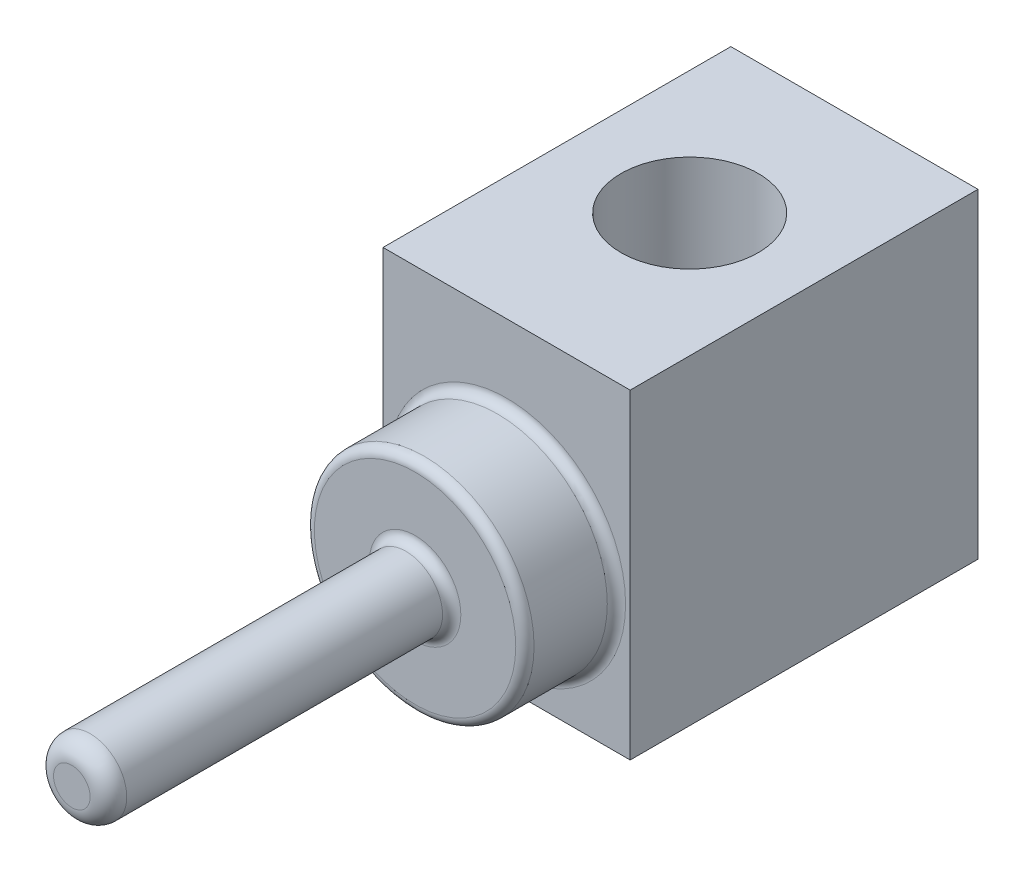
from build123d import *

# Parameters (mm, degrees)
SKETCH_1_W           = 2.7
SKETCH_1_H           = 3.5
EXTRUDE_1_DEPTH      = 3.8
SKETCH_2_OUTSIDE_W   = 5.866
SKETCH_2_OUTSIDE_H   = 6.666
SKETCH_2_OUTSIDE_W_2 = 2.7
SKETCH_2_OUTSIDE_H_2 = 3.5
SKETCH_2_OUTSIDE_R   = 1
CUT_EXTRUDE_1_DEPTH  = 5.396020928
SKETCH_4_OUTSIDE_W   = 5.866
SKETCH_4_OUTSIDE_H   = 6.966
SKETCH_4_OUTSIDE_W_2 = 2.7
SKETCH_4_OUTSIDE_H_2 = 3.8
SKETCH_4_OUTSIDE_R   = 0.75
CUT_EXTRUDE_2_DEPTH  = 1.85
SKETCH_7_R           = 1.2
EXTRUDE_3_DEPTH      = 1
SKETCH_8_R           = 0.4
EXTRUDE_4_DEPTH      = 3.75
FILLET_1_R           = 0.1
FILLET_2_R           = 0.1
FILLET_3_R           = 0.1
FILLET_4_R           = 0.2


with BuildPart() as part:
    # Эскиз1 → Бобышка-Вытянуть1 (new body)
    with BuildSketch(Plane.XY):
        Rectangle(SKETCH_1_W, SKETCH_1_H)
    extrude(amount=-EXTRUDE_1_DEPTH)

    # Эскиз2 outside → Вырез-Вытянуть1 (cut, through all)
    # profile 1 of 2: a face of its own
    with BuildSketch(Plane.XY):
        Rectangle(SKETCH_2_OUTSIDE_W, SKETCH_2_OUTSIDE_H)
        Rectangle(SKETCH_2_OUTSIDE_W_2, SKETCH_2_OUTSIDE_H_2, mode=Mode.SUBTRACT)
    # profile 2 of 2: a face of its own
    with BuildSketch(Plane.XY):
        with Locations((0, -0.3)):
            Circle(SKETCH_2_OUTSIDE_R)
    extrude(amount=-CUT_EXTRUDE_1_DEPTH, mode=Mode.SUBTRACT)

    # Эскиз4 outside → Вырез-Вытянуть2 (cut)
    # profile 1 of 2: a face of its own
    with BuildSketch(Plane(origin=(0, 1.75, 0), x_dir=(1, 0, 0), z_dir=(0, 1, 0))):
        with Locations((0, 1.9)):
            Rectangle(SKETCH_4_OUTSIDE_W, SKETCH_4_OUTSIDE_H)
        with Locations((0, 1.9)):
            Rectangle(SKETCH_4_OUTSIDE_W_2, SKETCH_4_OUTSIDE_H_2, mode=Mode.SUBTRACT)
    # profile 2 of 2: a face of its own
    with BuildSketch(Plane(origin=(0, 1.75, 0), x_dir=(1, 0, 0), z_dir=(0, 1, 0))):
        with Locations(Location((0, 2, 0), (0, 0, 270))):
            Circle(SKETCH_4_OUTSIDE_R)
    extrude(amount=-CUT_EXTRUDE_2_DEPTH, mode=Mode.SUBTRACT)

    # Эскиз7 → Бобышка-Вытянуть3 (add)
    with BuildSketch(Plane.XY):
        with Locations((0, -0.3)):
            Circle(SKETCH_7_R)
    extrude(amount=EXTRUDE_3_DEPTH)

    # Эскиз8 → Бобышка-Вытянуть4 (add)
    with BuildSketch(Plane.XY.offset(1)):
        with Locations((0, -0.3)):
            Circle(SKETCH_8_R)
    extrude(amount=EXTRUDE_4_DEPTH)

    # Скругление1
    fillet_1_edges = [part.edges().sort_by_distance(p)[0] for p in [
        (-1.2, -0.3, 1),
    ]]
    fillet(fillet_1_edges, radius=FILLET_1_R)

    # Скругление2
    fillet_2_edges = [part.edges().sort_by_distance(p)[0] for p in [
        (-1.2, -0.3, 0),
    ]]
    fillet(fillet_2_edges, radius=FILLET_2_R)

    # Скругление3
    fillet_3_edges = [part.edges().sort_by_distance(p)[0] for p in [
        (-0.4, -0.3, 1),
    ]]
    fillet(fillet_3_edges, radius=FILLET_3_R)

    # Скругление4
    fillet_4_edges = [part.edges().sort_by_distance(p)[0] for p in [
        (-0.4, -0.3, 4.75),
    ]]
    fillet(fillet_4_edges, radius=FILLET_4_R)


solid = part.part
